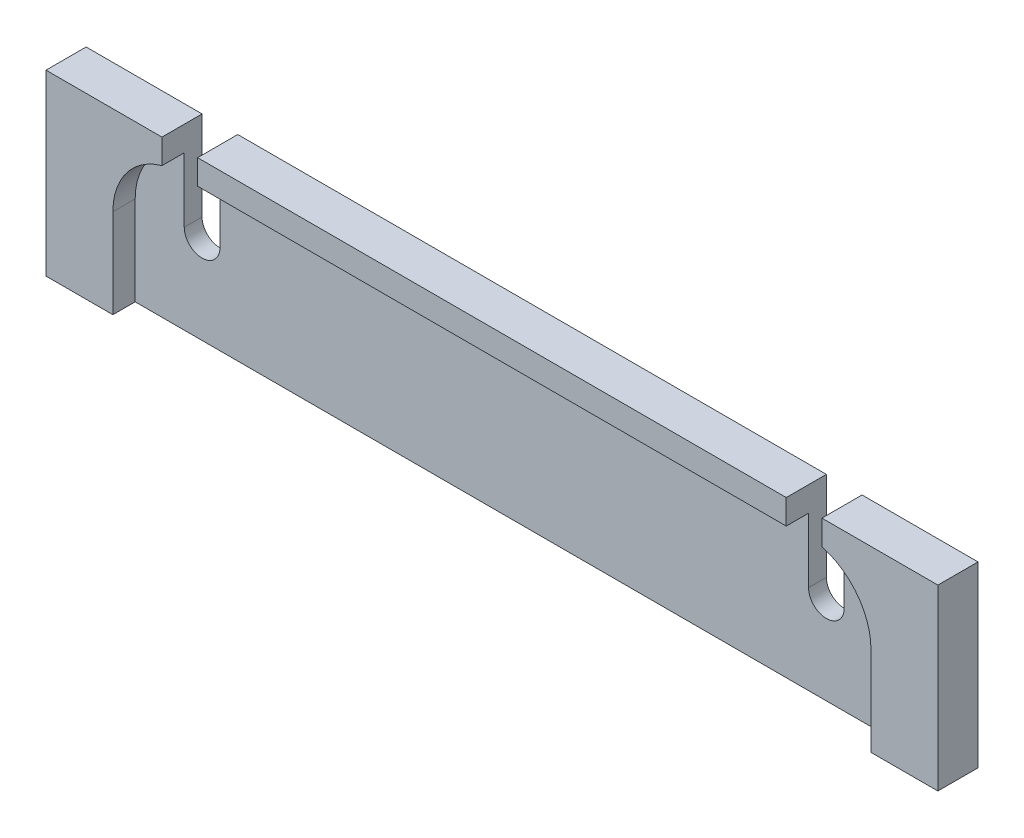
from build123d import *

# Parameters (mm, degrees)
EXTRUDE_1_DEPTH = 4
SKETCH_2_W      = 132
SKETCH_2_H      = 5.543167705
EXTRUDE_2_DEPTH = 5


with BuildPart() as part:
    # 스케치1 → 보스-돌출1 (new body)
    with BuildSketch(Plane.XY):
        with BuildLine():
            Line((100, 0), (-100, 0))
            Line((-100, 0), (-100, 40))
            Line((-100, 40), (-74, 40))
            Line((-74, 40), (-74, 20))
            ThreePointArc((-74, 20), (-70, 16), (-66, 20))
            Line((-66, 20), (-66, 40))
            Line((-66, 40), (66, 40))
            Line((66, 40), (66, 20))
            ThreePointArc((66, 20), (70, 16), (74, 20))
            Line((74, 20), (74, 40))
            Line((74, 40), (100, 40))
            Line((100, 40), (100, 0))
        make_face()
    extrude(amount=EXTRUDE_1_DEPTH)

    # 스케치2 → 보스-돌출2 (add)
    with BuildSketch(Plane.XY.offset(4)):
        with BuildLine():
            Line((-74, 34.456832295), (-74, 40))
            Line((-74, 40), (-100, 40))
            Line((-100, 40), (-100, 0))
            Line((-100, 0), (-85, 0))
            Line((-85, 0), (-85, 20))
            ThreePointArc((-85, 20), (-81.937336386, 29.082951062), (-74, 34.456832295))
        make_face()
        with Locations((0, 37.228416147)):
            Rectangle(SKETCH_2_W, SKETCH_2_H)
        with BuildLine():
            Line((74, 40), (74, 34.456832295))
            ThreePointArc((74, 34.456832295), (81.937336386, 29.082951062), (85, 20))
            Line((85, 20), (85, 0))
            Line((85, 0), (100, 0))
            Line((100, 0), (100, 40))
            Line((100, 40), (74, 40))
        make_face()
    extrude(amount=EXTRUDE_2_DEPTH)


solid = part.part
